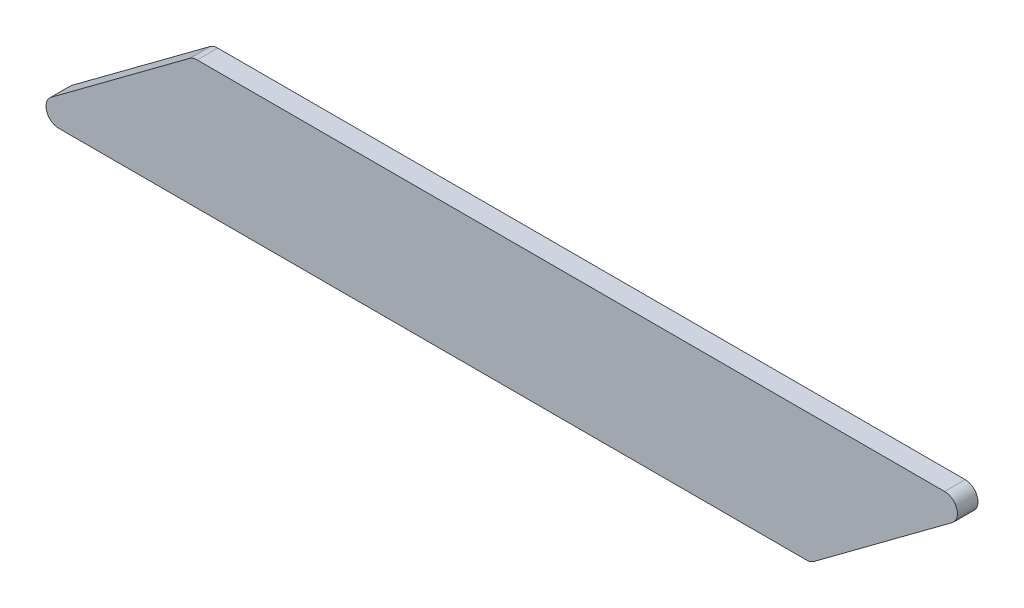
from build123d import *

# Parameters (mm, degrees)
SKETCH1_W               = 75
SKETCH1_H               = 10
BOSS_EXTRUDE1_DEPTH     = 1.6
CUT_EXTRUDE1_DEPTH      = 38.865683673
CUT_EXTRUDE1_DEPTH_BACK = 10
FILLET2_R               = 1


with BuildPart() as part:
    # Sketch1 → Boss-Extrude1 (new body)
    with BuildSketch(Plane.XY):
        Rectangle(SKETCH1_W, SKETCH1_H)
    extrude(amount=BOSS_EXTRUDE1_DEPTH)

    # Sketch2 → Cut-Extrude1 (cut, two sides: drawn at the far end of the back side and taken through both)
    with BuildSketch(Plane.XY.offset(1.6).offset(-CUT_EXTRUDE1_DEPTH_BACK)):
        Polygon((37.5, -5), (37.5, 5), (24.04554885, -5), align=None)
        Polygon((-37.5, -5), (-24.04554885, 5), (-37.5, 5), align=None)
    extrude(amount=CUT_EXTRUDE1_DEPTH + CUT_EXTRUDE1_DEPTH_BACK, mode=Mode.SUBTRACT)

    # Fillet2
    fillet2_edges = [part.edges().sort_by_distance(p)[0] for p in [
        (24.04554885, -5, 0.8),
        (-24.04554885, 5, 0.8),
        (-37.5, -5, 0.8),
        (37.5, 5, 0.8),
    ]]
    fillet(fillet2_edges, radius=FILLET2_R)


solid = part.part
